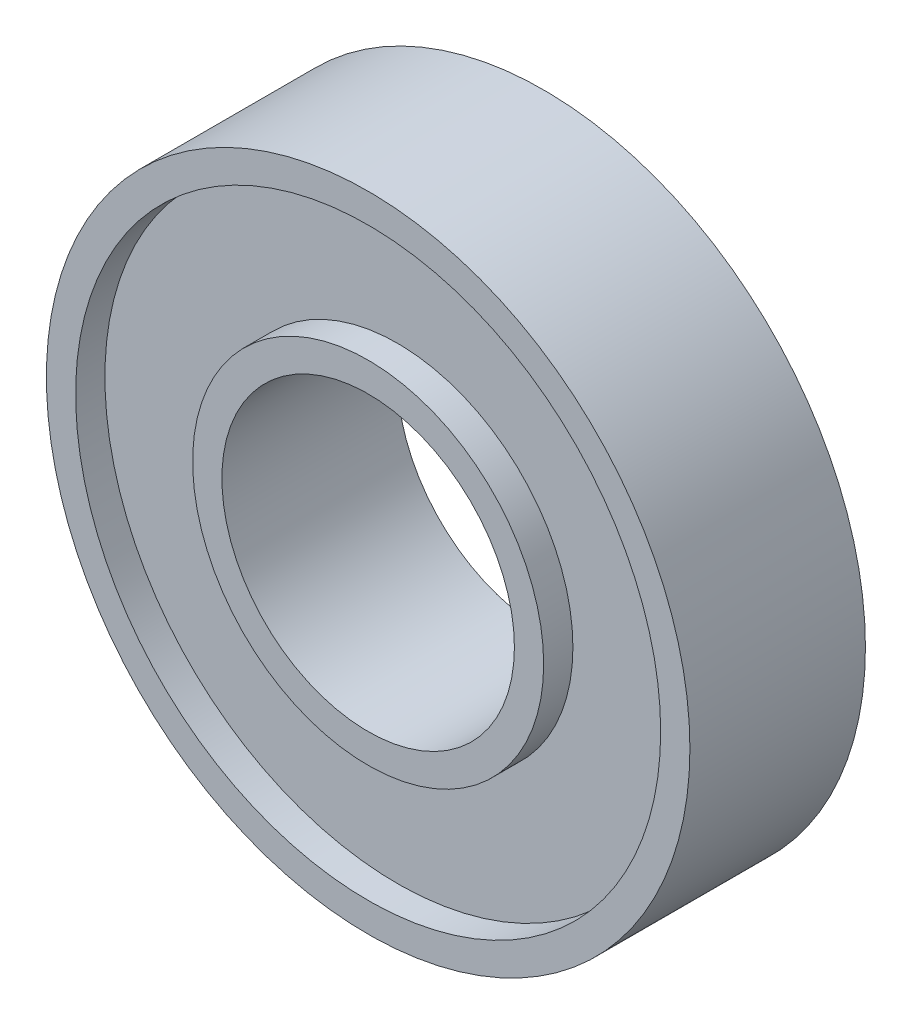
from build123d import *


with BuildPart() as part:
    # ｽｹｯﾁ1 → 回転1 (revolve)
    with BuildSketch(Plane(origin=(0, 0, 0), x_dir=(0, 0, -1), z_dir=(1, 0, 0)), mode=Mode.PRIVATE) as revolve_1_sk:
        Polygon((3, 11), (-3, 11), (-3, 10), (-2, 10), (-2, 6), (-3, 6), (-3, 5), (3, 5), (3, 6), (2, 6), (2, 10), (3, 10), align=None)
    revolve(revolve_1_sk.sketch.rotate(Axis((0, 0, 0), (0, 0, -1)), 90), axis=Axis((0, 0, 0), (0, 0, -1)))


solid = part.part
